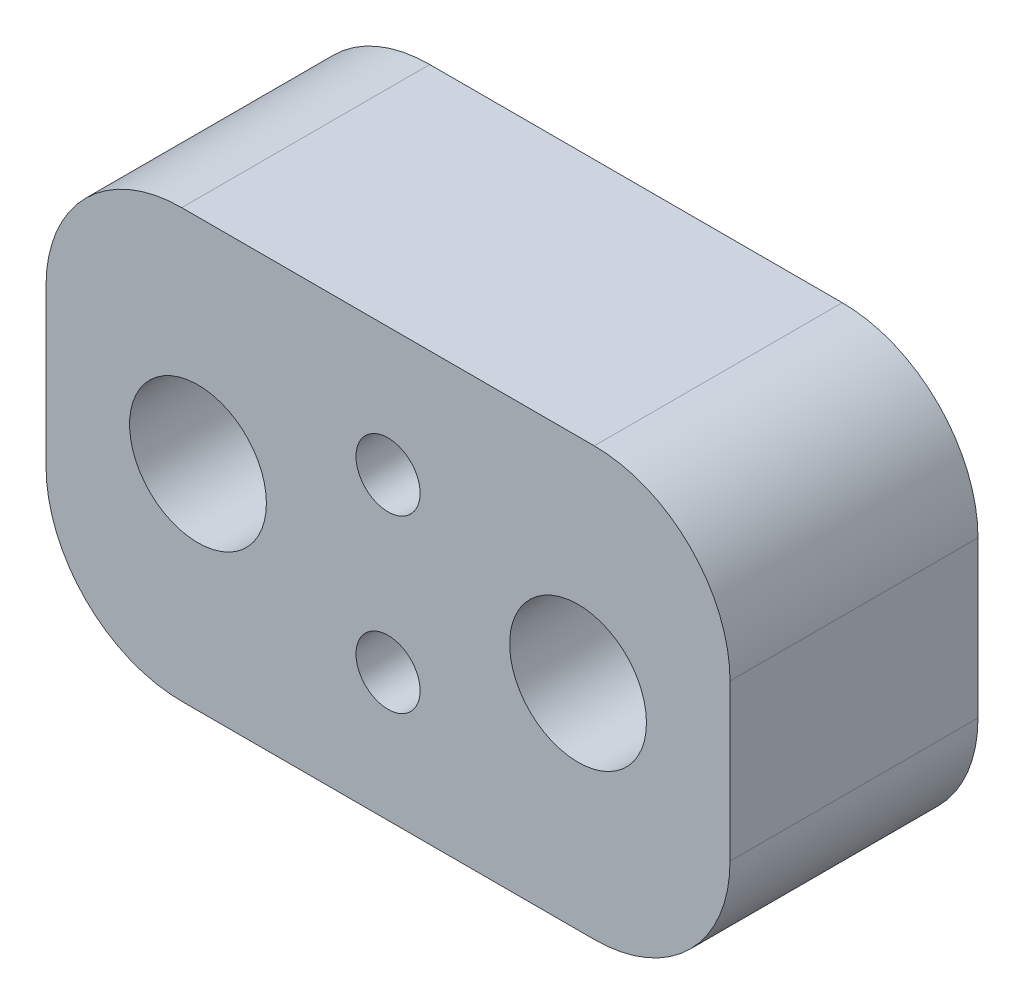
from build123d import *

# Parameters (mm, degrees)
SKETCH1_W                = 16
SKETCH1_H                = 10
BOSS_EXTRUDE1_DEPTH      = 5.8
SKETCH2_R                = 0.75
CUT_EXTRUDE1_DEPTH       = 5.8
M3_CLEARANCE_HOLE1_D     = 3.2
M3_CLEARANCE_HOLE1_DEPTH = 36.28
M3_CLEARANCE_HOLE1_TIP   = 0.96137699
FILLET1_R                = 3.175


with BuildPart() as part:
    # Sketch1 → Boss-Extrude1 (new body)
    with BuildSketch(Plane.XY):
        with Locations((8, 5)):
            Rectangle(SKETCH1_W, SKETCH1_H)
    extrude(amount=BOSS_EXTRUDE1_DEPTH)

    # Sketch2 → Cut-Extrude1 (cut)
    with BuildSketch(Plane.XY.offset(5.8)):
        with Locations((8, 7)):
            Circle(SKETCH2_R)
        with Locations((8, 3)):
            Circle(SKETCH2_R)
    extrude(amount=-CUT_EXTRUDE1_DEPTH, mode=Mode.SUBTRACT)

    # M3 Clearance Hole1
    with Locations(Plane.XY.offset(5.8)):
        with Locations((3.555, 5), (12.445, 5)):
            Hole(M3_CLEARANCE_HOLE1_D / 2, depth=M3_CLEARANCE_HOLE1_DEPTH)
            with Locations((0, 0, -(M3_CLEARANCE_HOLE1_DEPTH + M3_CLEARANCE_HOLE1_TIP / 2))):  # 118° drill point
                Cone(0, M3_CLEARANCE_HOLE1_D / 2, M3_CLEARANCE_HOLE1_TIP, mode=Mode.SUBTRACT)

    # Fillet1
    fillet1_edges = [part.edges().sort_by_distance(p)[0] for p in [
        (0, 10, 2.9),
        (16, 10, 2.9),
        (16, 0, 2.9),
        (0, 0, 2.9),
    ]]
    fillet(fillet1_edges, radius=FILLET1_R)


solid = part.part
